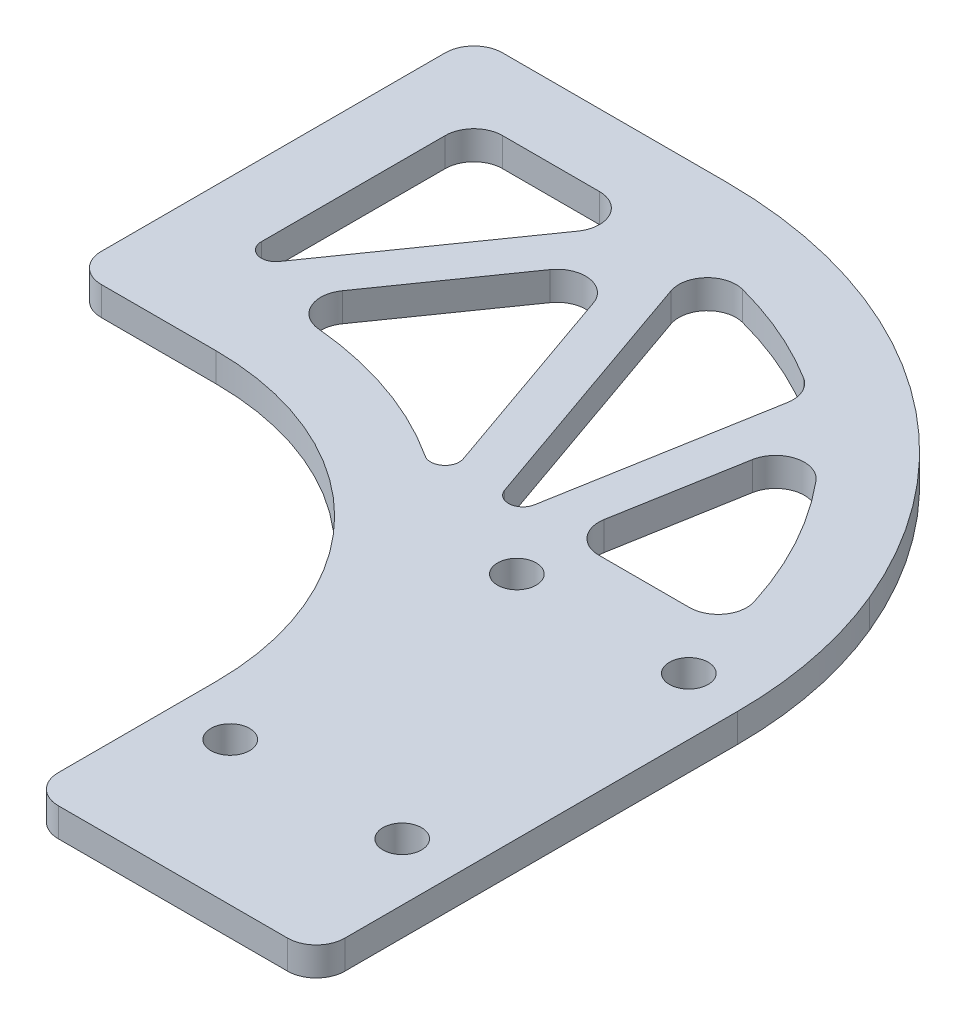
from build123d import *
from OCP.BRepFilletAPI import BRepFilletAPI_MakeFillet

# Parameters (mm, degrees)
SKETCH_1_W               = 20
SKETCH_1_H               = 32
SKETCH_1_R               = 1.35
EXTRUDE_1_DEPTH          = 2
EXTRUDE_2_DEPTH          = 2
FILLET_1_R               = 20
CUT_EXTRUDE_2_DEPTH      = 58.314919524
CUT_EXTRUDE_2_DEPTH_BACK = 58.314919524
FILLET_2_R1              = 2
FILLET_2_R2              = 1
FILLET_5_R               = 2
FILLET_6_R               = 30


with BuildPart() as part:
    # 草图1 → 凸台-拉伸1 (new body)
    with BuildSketch(Plane(origin=(0, 0, 0), x_dir=(1, 0, 0), z_dir=(0, 1, 0))):
        with Locations((0, -4)):
            Rectangle(SKETCH_1_W, SKETCH_1_H)
        with Locations(Location((-6, 10, 0), (0, 0, 270))):
            Circle(SKETCH_1_R, mode=Mode.SUBTRACT)
        with Locations(Location((6, 10, 0), (0, 0, 90))):
            Circle(SKETCH_1_R, mode=Mode.SUBTRACT)
        with Locations(Location((6, -10, 0), (0, 0, 270))):
            Circle(SKETCH_1_R, mode=Mode.SUBTRACT)
        with Locations(Location((-6, -10, 0), (0, 0, 90))):
            Circle(SKETCH_1_R, mode=Mode.SUBTRACT)
    extrude(amount=EXTRUDE_1_DEPTH)

    # 草图2 → 凸台-拉伸2 (add)
    with BuildSketch(Plane(origin=(0, 2, 0), x_dir=(1, 0, 0), z_dir=(0, 1, 0))):
        with BuildLine():
            Line((-40, 41), (-40, 13))
            Line((-40, 13), (-10, 13))
            Line((-10, 13), (-10, 12))
            Line((-10, 12), (10, 12))
            ThreePointArc((10, 12), (-0.654211509, 32.690782604), (-22.393061845, 41))
            Line((-22.393061845, 41), (-40, 41))
        make_face()
    extrude(amount=-EXTRUDE_2_DEPTH)

    # 圆角1
    fillet_1_edges = [part.edges().sort_by_distance(p)[0] for p in [
        (-10, 1, -13),
    ]]
    fillet(fillet_1_edges, radius=FILLET_1_R)

    # 草图3 → 切除-拉伸2 (cut, two sides: drawn at the far end of the back side and taken through both)
    with BuildSketch(Plane(origin=(0, 2, 0), x_dir=(1, 0, 0), z_dir=(0, 1, 0)).offset(-CUT_EXTRUDE_2_DEPTH_BACK)):
        Polygon((-22.393061845, 36), (-35, 36), (-35, 18), align=None)
        with BuildLine():
            Line((-31.337370064, 18), (-30, 18))
            ThreePointArc((-30, 18), (-21.339745962, 16.452078799), (-13.751923191, 12))
            Line((-13.751923191, 12), (-21.0069112, 32.749676509))
            Line((-21.0069112, 32.749676509), (-31.337370064, 18))
        make_face()
        with BuildLine():
            Line((-10.235217527, 11.031539438), (-18.887076306, 35.776345445))
            ThreePointArc((-18.887076306, 35.776345445), (-12.511241297, 34.169724991), (-6.696576783, 31.100168357))
            Line((-6.696576783, 31.100168357), (-10.235217527, 11.031539438))
        make_face()
        with BuildLine():
            Line((-6.665518003, 14), (4.625979988, 14))
            ThreePointArc((4.625979988, 14), (1.508463055, 22.192897882), (-4.021593898, 28.994438709))
            Line((-4.021593898, 28.994438709), (-6.665518003, 14))
        make_face()
    extrude(amount=CUT_EXTRUDE_2_DEPTH + CUT_EXTRUDE_2_DEPTH_BACK, mode=Mode.SUBTRACT)

    # 圆角2: one fillet with a radius per group of edges: ONE call of the kernel's fillet builder (fillet() takes one radius for all edges)
    fillet_2_edges_1 = [part.edges().sort_by_distance(p)[0] for p in [
        (-31.337370064, 1, -18),
        (-22.393061845, 1, -36),
        (-35, 1, -36),
        (-21.0069112, 1, -32.749676509),
        (-4.021593898, 1, -28.994438709),
        (-6.696576783, 1, -31.100168357),
        (-18.887076306, 1, -35.776345445),
        (4.625979988, 1, -14),
        (-6.665518003, 1, -14),
    ]]
    fillet_2_edges_2 = [part.edges().sort_by_distance(p)[0] for p in [
        (-35, 1, -18),
        (-13.751923191, 1, -12),
        (-10.235217527, 1, -11.031539438),
    ]]
    fillet_2 = BRepFilletAPI_MakeFillet(part.part.solid().wrapped)
    for e in fillet_2_edges_1:
        fillet_2.Add(FILLET_2_R1, e.wrapped)
    for e in fillet_2_edges_2:
        fillet_2.Add(FILLET_2_R2, e.wrapped)
    add(Compound.cast(fillet_2.Shape()), mode=Mode.REPLACE)

    # 圆角5
    fillet_5_edges = [part.edges().sort_by_distance(p)[0] for p in [
        (-40, 1, -13),
        (-40, 1, -41),
        (10, 1, 20),
        (-10, 1, 20),
    ]]
    fillet(fillet_5_edges, radius=FILLET_5_R)

    # 圆角6
    fillet_6_edges = [part.edges().sort_by_distance(p)[0] for p in [
        (10, 1, -12),
    ]]
    fillet(fillet_6_edges, radius=FILLET_6_R)


solid = part.part
